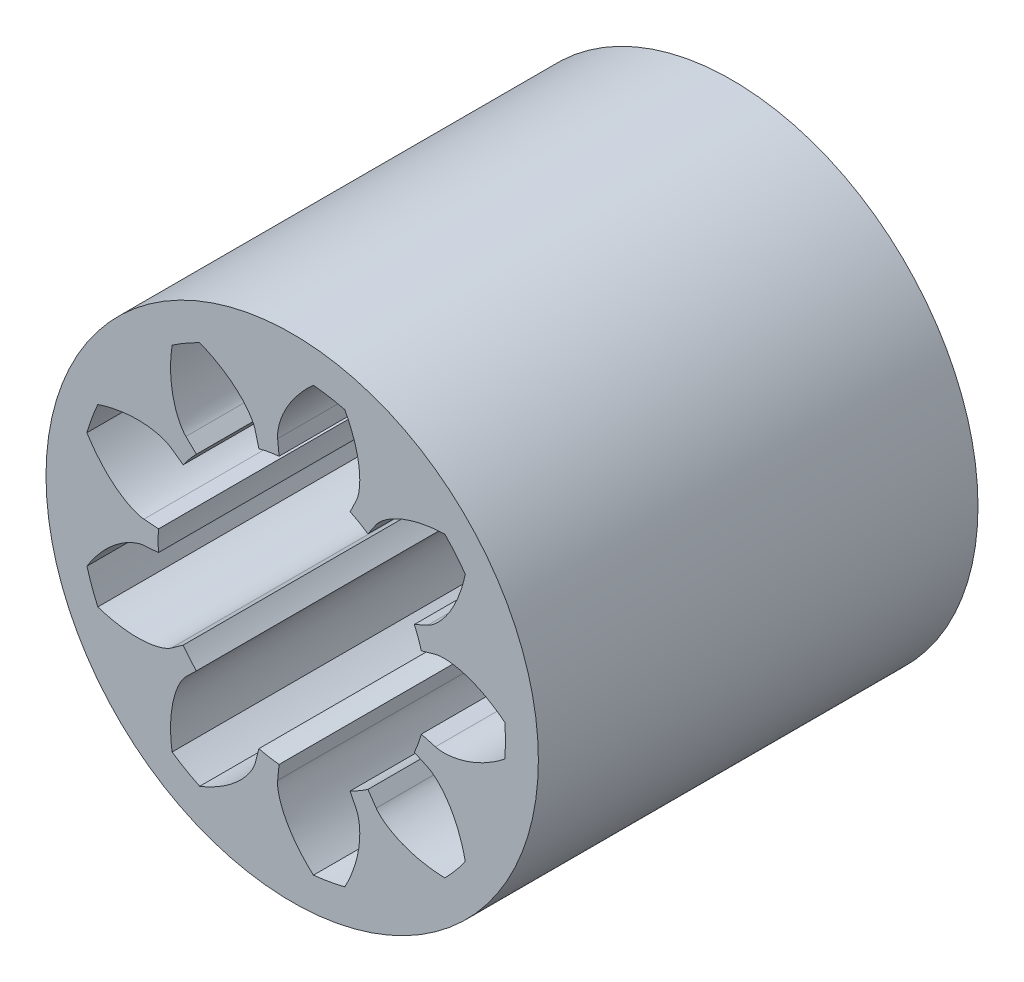
from build123d import *

# Parameters (mm, degrees)
SKETCH_1_R               = 2.8
SKETCH_1_R_2             = 1.525
EXTRUDE_1_DEPTH          = 5
CUT_EXTRUDE_2_DEPTH      = 7.378087488
PATTERN_CIRCULAR_1_COUNT = 9


with BuildPart() as part:
    # 草图1 → 凸台-拉伸1 (new body)
    with BuildSketch(Plane.XY):
        Circle(SKETCH_1_R)
        Circle(SKETCH_1_R_2, mode=Mode.SUBTRACT)
    extrude(amount=EXTRUDE_1_DEPTH)

    # 草图1<3> → 切除-拉伸2 (cut, through all)
    with BuildSketch(Plane.XY):
        with BuildLine():
            Line((1.629066618, 0.455119711), (1.468758411, 0.410333682))
            ThreePointArc((1.468758411, 0.410333682), (1.51087418, 0.207085035), (1.525, 0))
            ThreePointArc((1.525, 0), (1.51087418, -0.207085035), (1.468758411, -0.410333682))
            Line((1.468758411, -0.410333682), (1.629066618, -0.455119711))
            add(Edge.make_bspline(
                [(1.629066618, -0.455119711), (1.641483046, -0.458588545), (1.676886801, -0.465581385), (1.74601147, -0.46838824), (1.857617417, -0.457440389), (1.998539397, -0.420943181), (2.163995746, -0.351850331), (2.289812361, -0.276606271), (2.373454255, -0.216312222), (2.418244016, -0.180889134)],
                knots=[0, 0, 0, 0, 0, 0.005604068, 0.015718248, 0.029959916, 0.048733667, 0.068727063, 0.093605144, 0.093605144, 0.093605144, 0.093605144, 0.093605144], degree=4))
            ThreePointArc((2.418244016, -0.180889134), (2.423310415, -0.090507627), (2.425, 0))
            ThreePointArc((2.425, 0), (2.423310415, 0.090507627), (2.418244016, 0.180889134))
            add(Edge.make_bspline(
                [(1.629066618, 0.455119711), (1.641483046, 0.458588545), (1.676886801, 0.465581385), (1.74601147, 0.46838824), (1.857617417, 0.457440389), (1.998539397, 0.420943181), (2.163995746, 0.351850331), (2.289812361, 0.276606271), (2.373454255, 0.216312222), (2.418244016, 0.180889134)],
                knots=[0, 0, 0, 0, 0, 0.005604068, 0.015718248, 0.029959916, 0.048733667, 0.068727063, 0.093605144, 0.093605144, 0.093605144, 0.093605144, 0.093605144], degree=4))
        make_face()
    cut_extrude_2 = extrude(amount=CUT_EXTRUDE_2_DEPTH, mode=Mode.SUBTRACT)

    # 阵列(圆周)1: 切除-拉伸2 ×9 about axis
    pattern_circular_1_axis = Axis((0, 0, 5), (0, 0, 1))
    for i in range(1, PATTERN_CIRCULAR_1_COUNT):
        add(cut_extrude_2.rotate(pattern_circular_1_axis, i * 360 / PATTERN_CIRCULAR_1_COUNT), mode=Mode.SUBTRACT)


solid = part.part
